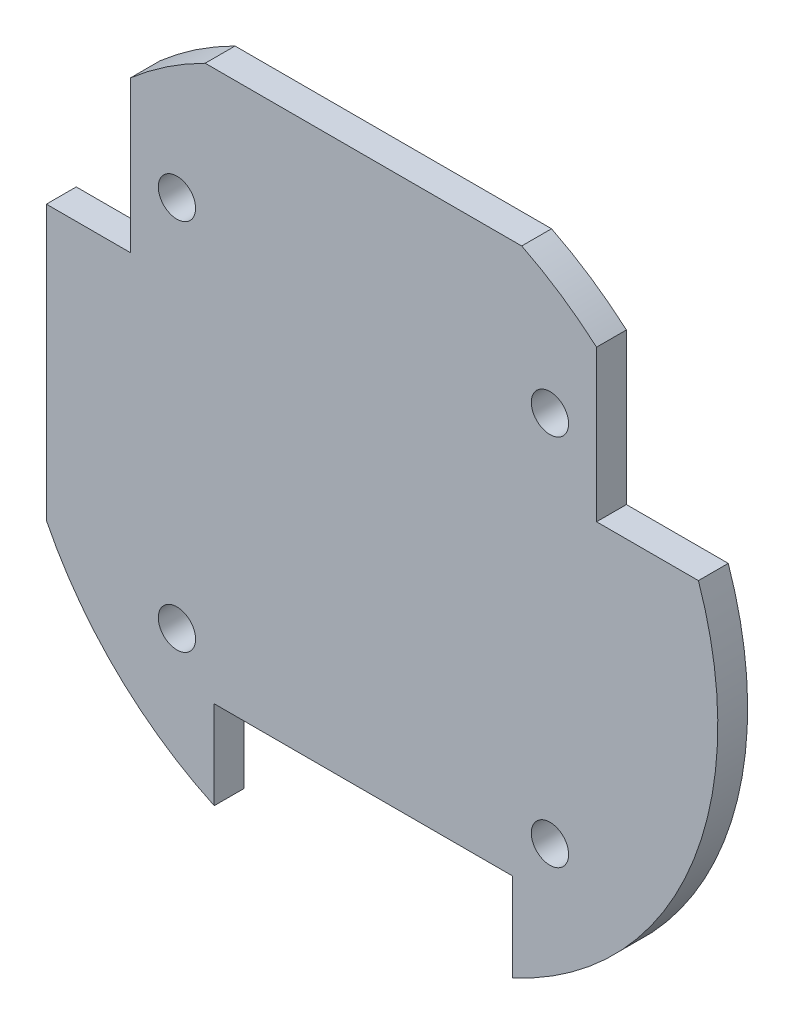
from build123d import *

# Parameters (mm, degrees)
SKETCH1_R           = 19
SKETCH1_R_2         = 1
BOSS_EXTRUDE1_DEPTH = 1.6
SKETCH2_W           = 16.970562748
SKETCH2_H           = 3.563360777
SKETCH2_W_2         = 5.149879678
SKETCH2_H_2         = 16.970562749
CUT_EXTRUDE1_DEPTH  = 1.6
CUT_EXTRUDE2_DEPTH  = 1.6
SKETCH4_W           = 16
SKETCH4_H           = 11.067837439
CUT_EXTRUDE3_DEPTH  = 1.6


with BuildPart() as part:
    # Sketch1 → Boss-Extrude1 (new body)
    with BuildSketch(Plane.XY):
        with Locations((0, -13.250389013)):
            Circle(SKETCH1_R)
        with Locations((-10, -3.250389013)):
            Circle(SKETCH1_R_2, mode=Mode.SUBTRACT)
        with Locations((10, -3.250389013)):
            Circle(SKETCH1_R_2, mode=Mode.SUBTRACT)
        with Locations((10, -23.250389013)):
            Circle(SKETCH1_R_2, mode=Mode.SUBTRACT)
        with Locations((-10, -23.250389013)):
            Circle(SKETCH1_R_2, mode=Mode.SUBTRACT)
    extrude(amount=BOSS_EXTRUDE1_DEPTH)

    # Sketch2 → Cut-Extrude1 (cut)
    with BuildSketch(Plane.XY.offset(1.6)):
        with Locations((0, 5.531291376)):
            Rectangle(SKETCH2_W, SKETCH2_H)
        with Locations((-19.574939839, -13.250389013)):
            Rectangle(SKETCH2_W_2, SKETCH2_H_2)
    extrude(amount=-CUT_EXTRUDE1_DEPTH, mode=Mode.SUBTRACT)

    # Sketch3 → Cut-Extrude2 (cut)
    with BuildSketch(Plane(origin=(0, 0, 0), x_dir=(-1, 0, 0), z_dir=(0, 0, -1))):
        Polygon((12.5, -5.150389013), (12.5, -7.050389013), (17, -7.050389013), (24.21815824, -7.050389013), (24.21815824, 1.058699009), (18.989854596, 1.058699009), (12.5, 1.058699009), align=None)
    cut_extrude2 = extrude(amount=-CUT_EXTRUDE2_DEPTH, mode=Mode.SUBTRACT)

    # Mirror1: Cut-Extrude2 across plane
    add(cut_extrude2.mirror(Plane(origin=(0, 0, 0), x_dir=(0, 0, 1), z_dir=(1, 0, 0))), mode=Mode.SUBTRACT)

    # Sketch4 → Cut-Extrude3 (cut)
    with BuildSketch(Plane.XY.offset(1.6)):
        with Locations((0, -31.284307733)):
            Rectangle(SKETCH4_W, SKETCH4_H)
    extrude(amount=-CUT_EXTRUDE3_DEPTH, mode=Mode.SUBTRACT)


solid = part.part
